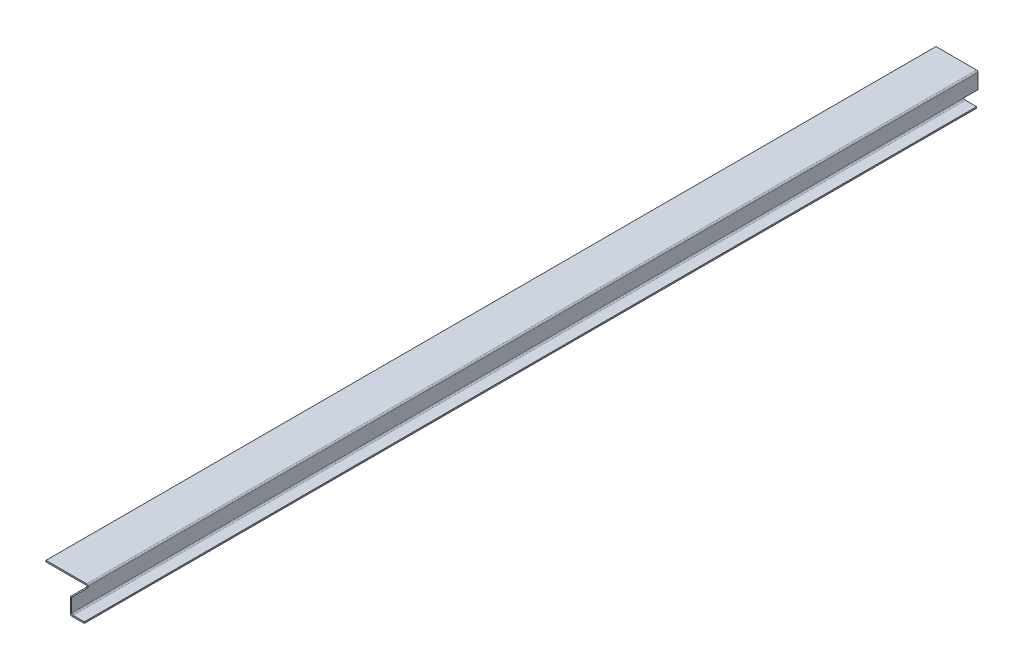
from build123d import *

# Parameters (mm, degrees)
BOSS_EXTRUDE1_DEPTH = 1940
FILLET1_R           = 3
SKETCH2_W           = 90
SKETCH2_H           = 35
CUT_EXTRUDE3_DEPTH  = 6
SKETCH3_W           = 30
SKETCH3_H           = 30
CUT_EXTRUDE4_DEPTH  = 6


with BuildPart() as part:
    # Sketch1 → Boss-Extrude1 (new body)
    with BuildSketch(Plane.XY):
        Polygon((0, 0), (87, 0), (87, -38), (117, -38), (117, -35), (90, -35), (90, 3), (0, 3), align=None)
    extrude(amount=BOSS_EXTRUDE1_DEPTH)

    # Fillet1
    fillet1_edges = [part.edges().sort_by_distance(p)[0] for p in [
        (90, 3, 970),
        (90, -35, 970),
        (87, -38, 970),
        (87, 0, 970),
    ]]
    fillet(fillet1_edges, radius=FILLET1_R)

    # Sketch2 → Cut-Extrude3 (cut)
    with BuildSketch(Plane(origin=(0, 3, 0), x_dir=(1, 0, 0), z_dir=(0, 1, 0))):
        with Locations((45, -1922.5)):
            Rectangle(SKETCH2_W, SKETCH2_H)
    extrude(amount=-CUT_EXTRUDE3_DEPTH, mode=Mode.SUBTRACT)

    # Sketch3 → Cut-Extrude4 (cut)
    with BuildSketch(Plane.XZ.offset(38)):
        with Locations((102, 15)):
            Rectangle(SKETCH3_W, SKETCH3_H)
    extrude(amount=-CUT_EXTRUDE4_DEPTH, mode=Mode.SUBTRACT)


solid = part.part
